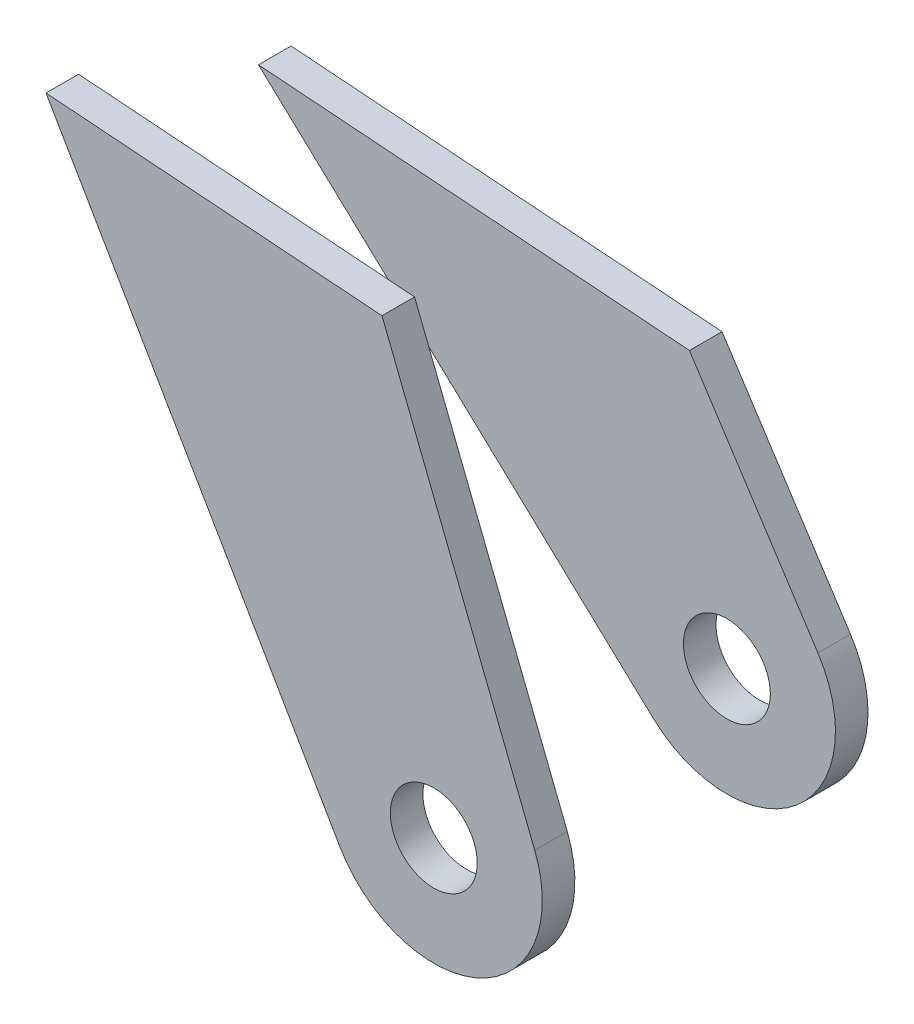
from build123d import *

# Parameters (mm, degrees)
F_3DSKETCH1_R       = 4
BOSS_EXTRUDE1_DEPTH = 3
BOSS_EXTRUDE2_START = 3
F_3DSKETCH1_3_R     = 4
BOSS_EXTRUDE2_DEPTH = 3


with BuildPart() as part:
    # 3DSketch1 → Boss-Extrude1 (new body)
    with BuildSketch(Plane(origin=(210.284879759, -2159.432918783, 234), x_dir=(0.765045268055925, -0.643976504094084, 0), z_dir=(0, 0, -1))):
        with BuildLine():
            Line((0, 0), (25.150628352, -18.174318588))
            Line((25.150628352, -18.174318588), (58.839790062, 0))
            ThreePointArc((58.839790062, 0), (63.223787862, 12.876385034), (50.7119139, 18.212463954))
            Line((50.7119139, 18.212463954), (0, 0))
        make_face()
        with Locations(Location((54.091907386, 8.801000516, 0), (0, 0, 319.911019429))):
            Circle(F_3DSKETCH1_R, mode=Mode.SUBTRACT)
    extrude(amount=-BOSS_EXTRUDE1_DEPTH)


with BuildPart() as body_2:
    # 3DSketch1<3> → Boss-Extrude2 (new body)
    with BuildSketch(Plane(origin=(239.174999692, -2208.308855642, 210), x_dir=(-0.7308855641899759, 0.6825000308122343, 0), z_dir=(0, 0, -1)).offset(BOSS_EXTRUDE2_START)):
        with BuildLine():
            Line((0, 0), (49.689163225, 0))
            Line((49.689163225, 0), (18.669359488, 24.943165231))
            Line((18.669359488, 24.943165231), (-2.411519809, 19.704873632))
            ThreePointArc((-2.411519809, 19.704873632), (-9.925944195, 8.785244123), (0, 0))
        make_face()
        with Locations(Location((0, 10, 0), (0, 0, 136.960685483))):
            Circle(F_3DSKETCH1_3_R, mode=Mode.SUBTRACT)
    extrude(amount=-BOSS_EXTRUDE2_DEPTH)


solid = Compound([part.part, body_2.part])
